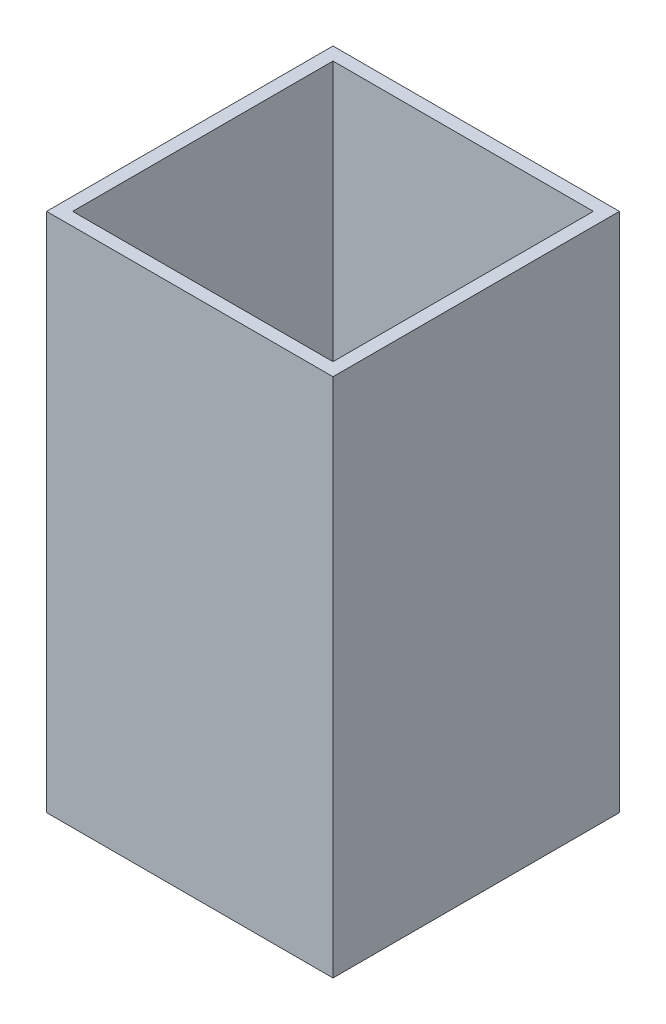
from build123d import *

# Parameters (mm, degrees)
SKETCH_1_W               = 55
SKETCH_1_H               = 55
EXTRUDE_1_DEPTH          = 100
CUT_EXTRUDE_1_DEPTH      = 108.296318669
CUT_EXTRUDE_1_DEPTH_BACK = 108.296318669
SKETCH_2_W               = 50
SKETCH_2_H               = 50


with BuildPart() as part:
    # 草图1 → 凸台-拉伸1 (new body)
    with BuildSketch(Plane(origin=(0, 0, 0), x_dir=(1, 0, 0), z_dir=(0, 1, 0))):
        Rectangle(SKETCH_1_W, SKETCH_1_H)
    extrude(amount=EXTRUDE_1_DEPTH)

    # 草图2 → 切除-拉伸1 (cut, two sides: drawn at the far end of the back side and taken through both)
    with BuildSketch(Plane(origin=(0, 0, 0), x_dir=(1, 0, 0), z_dir=(0, 1, 0)).offset(-CUT_EXTRUDE_1_DEPTH_BACK)):
        Rectangle(SKETCH_2_W, SKETCH_2_H)
    extrude(amount=CUT_EXTRUDE_1_DEPTH + CUT_EXTRUDE_1_DEPTH_BACK, mode=Mode.SUBTRACT)


solid = part.part
